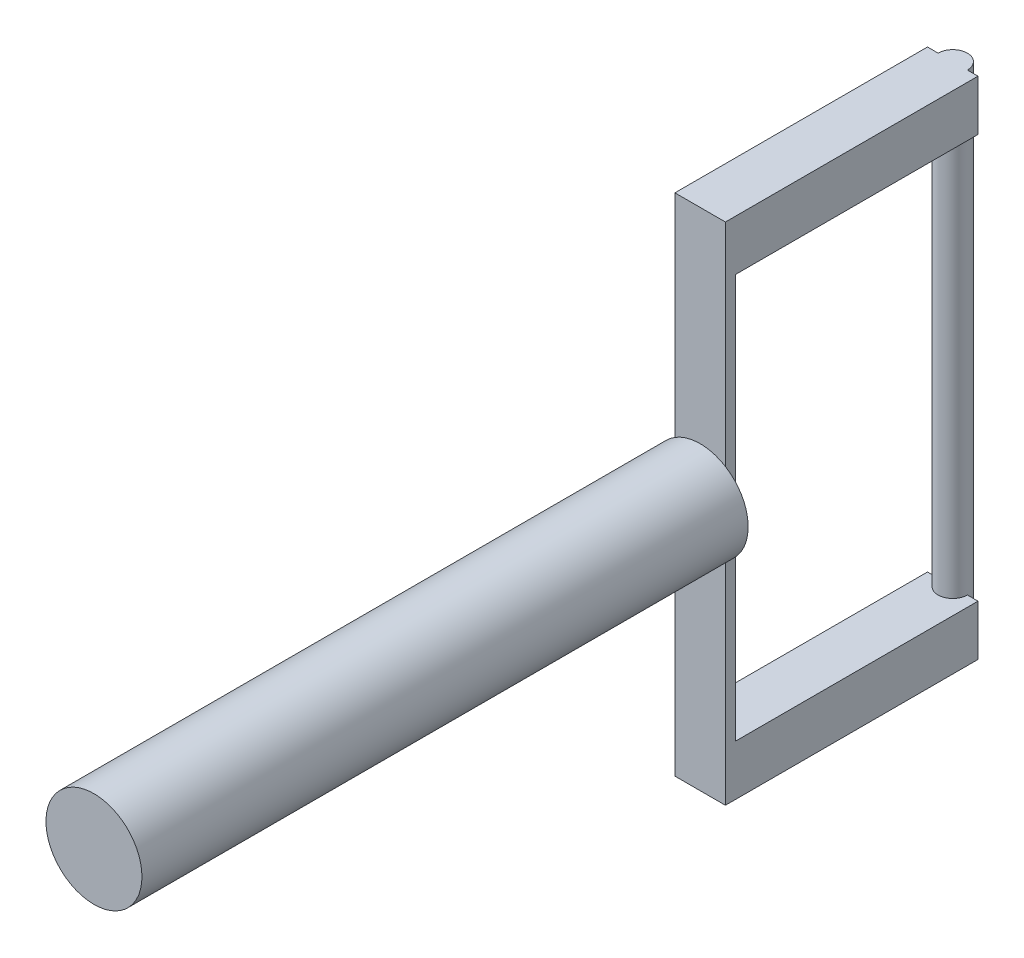
from build123d import *

# Parameters (mm, degrees)
SKETCH_1_R      = 0.29
EXTRUDE_1_DEPTH = 5
SKETCH_2_W      = 1
SKETCH_2_H      = 1
EXTRUDE_2_DEPTH = 5
SKETCH_3_W      = 1
SKETCH_3_H      = 8
EXTRUDE_3_DEPTH = 0.2
SKETCH_4_R      = 0.95
EXTRUDE_4_DEPTH = 12


with BuildPart() as part:
    # 草图1 → 凸台-拉伸1 (new, symmetric)
    with BuildSketch(Plane(origin=(0, 0, 0), x_dir=(1, 0, 0), z_dir=(0, 1, 0))):
        with Locations(Location((0, 0, 0), (0, 0, 270))):
            Circle(SKETCH_1_R)
    extrude(amount=EXTRUDE_1_DEPTH, both=True)

    # 草图2 → 凸台-拉伸2 (add)
    with BuildSketch(Plane.XY):
        with Locations((0, 4.5)):
            Rectangle(SKETCH_2_W, SKETCH_2_H)
        with Locations((0, -4.5)):
            Rectangle(SKETCH_2_W, SKETCH_2_H)
    extrude(amount=EXTRUDE_2_DEPTH)

    # 草图3 → 凸台-拉伸3 (add)
    with BuildSketch(Plane.XY.offset(5)):
        Rectangle(SKETCH_3_W, SKETCH_3_H)
    extrude(amount=-EXTRUDE_3_DEPTH)

    # 草图4 → 凸台-拉伸4 (add)
    with BuildSketch(Plane.XY.offset(5)):
        with Locations(Location((0, 0, 0), (0, 0, 121.756863859))):
            Circle(SKETCH_4_R)
    extrude(amount=EXTRUDE_4_DEPTH)


solid = part.part
